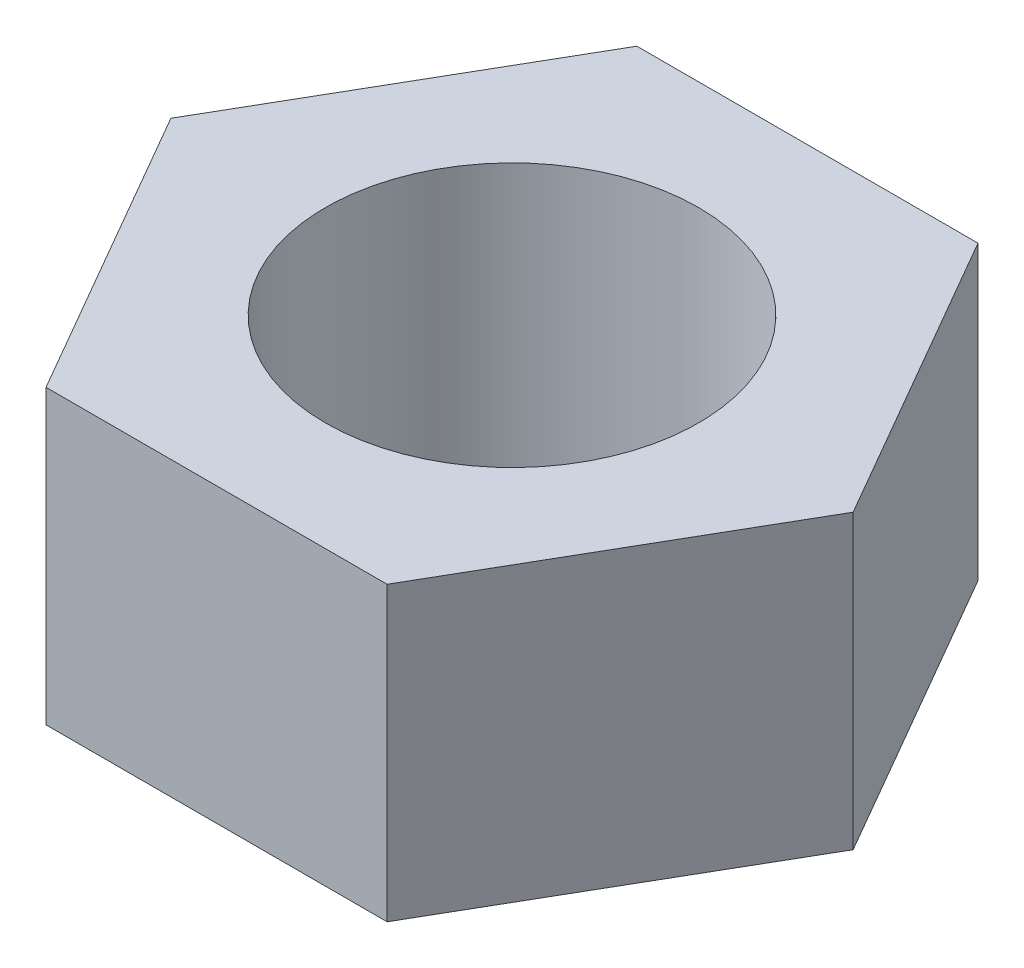
from build123d import *

# Parameters (mm, degrees)
SKETCH1_R           = 6
BOSS_EXTRUDE1_DEPTH = 9.4


with BuildPart() as part:
    # Sketch1 → Boss-Extrude1 (new body)
    with BuildSketch(Plane(origin=(0, 0, 0), x_dir=(1, 0, 0), z_dir=(0, 1, 0))):
        Polygon((5.484827557, 9.5), (-5.484827557, 9.5), (-10.969655115, 0), (-5.484827557, -9.5), (5.484827557, -9.5), (10.969655115, 0), align=None)
        with Locations(Location((0, 0, 0), (0, 0, 270))):
            Circle(SKETCH1_R, mode=Mode.SUBTRACT)
    extrude(amount=BOSS_EXTRUDE1_DEPTH)


solid = part.part
